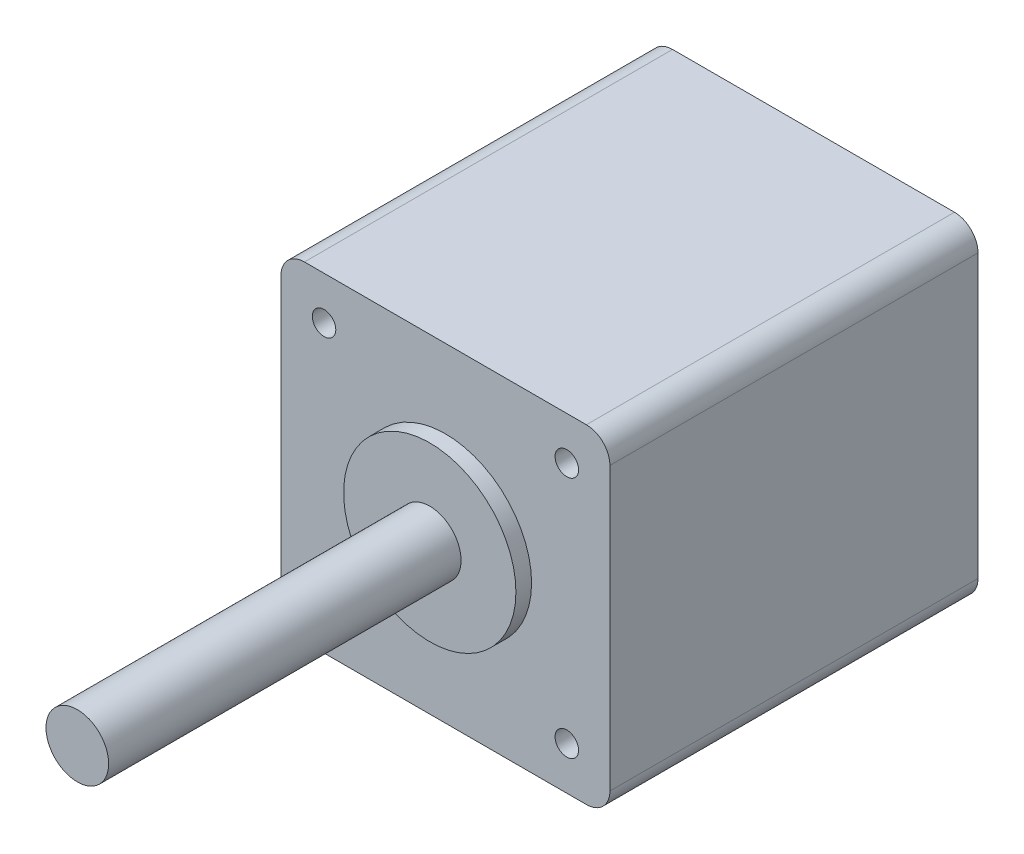
from build123d import *

# Parameters (mm, degrees)
EXTRUDE_1_DEPTH     = 47
SKETCH_2_R          = 11
EXTRUDE_2_DEPTH     = 2
SKETCH_3_R          = 4
EXTRUDE_3_DEPTH     = 45
SKETCH_6_R          = 1.5
CUT_EXTRUDE_2_DEPTH = 3.5


with BuildPart() as part:
    # 草图1 → 凸台-拉伸1 (new body)
    with BuildSketch(Plane.XY):
        with BuildLine():
            Line((18, -21), (-18, -21))
            ThreePointArc((-18, -21), (-20.121320344, -20.121320344), (-21, -18))
            Line((-21, -18), (-21, 18))
            ThreePointArc((-21, 18), (-20.121320344, 20.121320344), (-18, 21))
            Line((-18, 21), (18, 21))
            ThreePointArc((18, 21), (20.121320344, 20.121320344), (21, 18))
            Line((21, 18), (21, -18))
            ThreePointArc((21, -18), (20.121320344, -20.121320344), (18, -21))
        make_face()
    extrude(amount=EXTRUDE_1_DEPTH)

    # 草图2 → 凸台-拉伸2 (add)
    with BuildSketch(Plane.XY.offset(47)):
        Circle(SKETCH_2_R)
    extrude(amount=EXTRUDE_2_DEPTH)

    # 草图3 → 凸台-拉伸3 (add)
    with BuildSketch(Plane.XY.offset(49)):
        with Locations(Location((0, 0, 0), (0, 0, 180))):
            Circle(SKETCH_3_R)
    extrude(amount=EXTRUDE_3_DEPTH)

    # 草图6 → 切除-拉伸2 (cut)
    with BuildSketch(Plane.XY.offset(47)):
        with Locations((-15.5, 15.5)):
            Circle(SKETCH_6_R)
        with Locations((15.5, 15.5)):
            Circle(SKETCH_6_R)
        with Locations((15.5, -15.5)):
            Circle(SKETCH_6_R)
        with Locations((-15.5, -15.5)):
            Circle(SKETCH_6_R)
    extrude(amount=-CUT_EXTRUDE_2_DEPTH, mode=Mode.SUBTRACT)


solid = part.part
